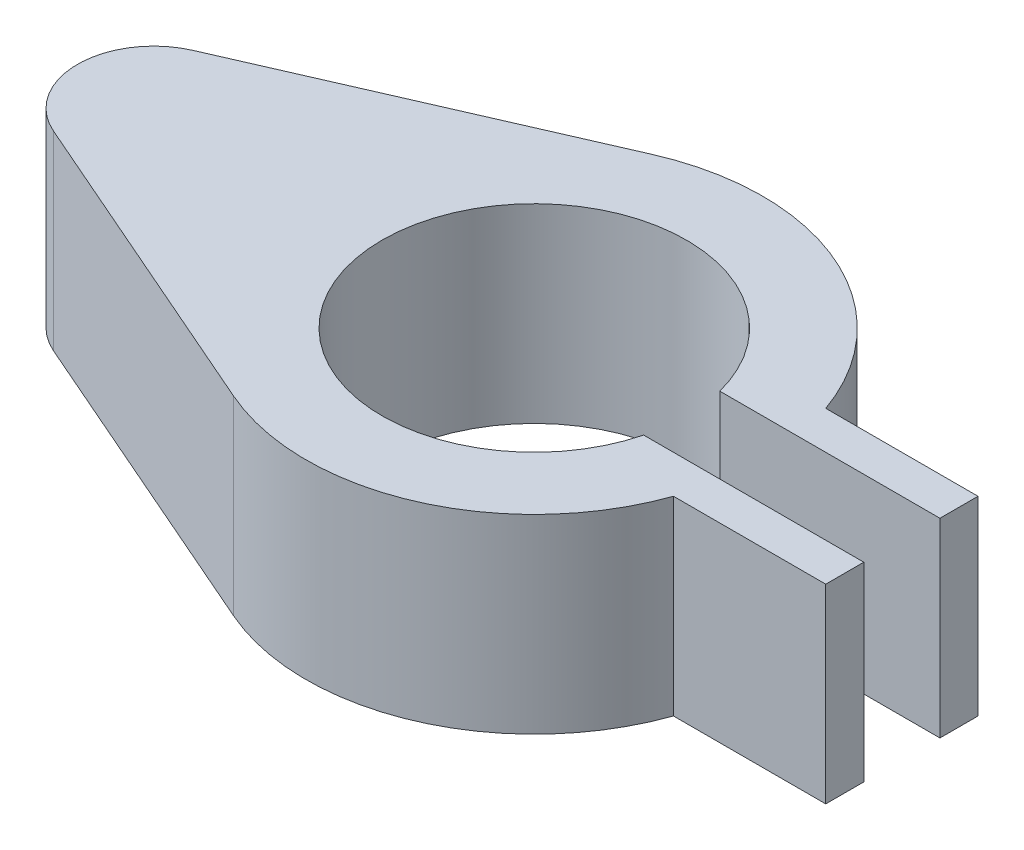
from build123d import *

# Parameters (mm, degrees)
RESSALTO_EXTRUS_O1_DEPTH = 5
ESBO_O3_W                = 4
ESBO_O3_H                = 4
RESSALTO_EXTRUS_O2_DEPTH = 5
ESBO_O5_W                = 9.102985385
ESBO_O5_H                = 2
CORTE_EXTRUS_O1_DEPTH    = 5


with BuildPart() as part:
    # Esboço2 → Ressalto-extrusão1 (new body)
    with BuildSketch(Plane(origin=(0, 0, 0), x_dir=(1, 0, 0), z_dir=(0, 1, 0))):
        with BuildLine():
            ThreePointArc((-2.4, -5.499090834), (3.286335345, -5.019960159), (6, 0))
            Line((6, 0), (4, 0))
            ThreePointArc((4, 0), (0, -4), (-4, 0))
            Line((-4, 0), (-6, 0))
            ThreePointArc((-6, 0), (-5.019960159, -3.286335345), (-2.4, -5.499090834))
        make_face()
        with BuildLine():
            Line((4, 0), (6, 0))
            ThreePointArc((6, 0), (3.286335345, 5.019960159), (-2.4, 5.499090834))
            ThreePointArc((-2.4, 5.499090834), (-5.019960159, 3.286335345), (-6, 0))
            Line((-6, 0), (-4, 0))
            ThreePointArc((-4, 0), (0, 4), (4, 0))
        make_face()
        with BuildLine():
            Line((-10.8, -1.833030278), (-2.4, -5.499090834))
            ThreePointArc((-2.4, -5.499090834), (-5.019960159, -3.286335345), (-6, 0))
            Line((-6, 0), (-8, 0))
            ThreePointArc((-8, 0), (-8.904554885, -1.673320053), (-10.8, -1.833030278))
        make_face()
        with BuildLine():
            ThreePointArc((-6, 0), (-5.019960159, 3.286335345), (-2.4, 5.499090834))
            Line((-2.4, 5.499090834), (-10.8, 1.833030278))
            ThreePointArc((-10.8, 1.833030278), (-8.904554885, 1.673320053), (-8, 0))
            Line((-8, 0), (-6, 0))
        make_face()
        with BuildLine():
            ThreePointArc((-8, 0), (-8.904554885, 1.673320053), (-10.8, 1.833030278))
            ThreePointArc((-10.8, 1.833030278), (-11.673320053, 1.095445115), (-12, 0))
            Line((-12, 0), (-8, 0))
        make_face()
        with BuildLine():
            ThreePointArc((-12, 0), (-11.673320053, -1.095445115), (-10.8, -1.833030278))
            ThreePointArc((-10.8, -1.833030278), (-8.904554885, -1.673320053), (-8, 0))
            Line((-8, 0), (-12, 0))
        make_face()
    extrude(amount=RESSALTO_EXTRUS_O1_DEPTH)

    # Esboço3 → Ressalto-extrusão2 (add, through all)
    with BuildSketch(Plane(origin=(0, 5, 0), x_dir=(1, 0, 0), z_dir=(0, 1, 0))):
        with Locations((7.656854249, 0)):
            Rectangle(ESBO_O3_W, ESBO_O3_H)
    extrude(amount=-RESSALTO_EXTRUS_O2_DEPTH)

    # Esboço5 → Corte-extrusão1 (cut)
    with BuildSketch(Plane(origin=(0, 5, 0), x_dir=(1, 0, 0), z_dir=(0, 1, 0))):
        with Locations((6.873009698, 0)):
            Rectangle(ESBO_O5_W, ESBO_O5_H)
    extrude(amount=-CORTE_EXTRUS_O1_DEPTH, mode=Mode.SUBTRACT)


solid = part.part
